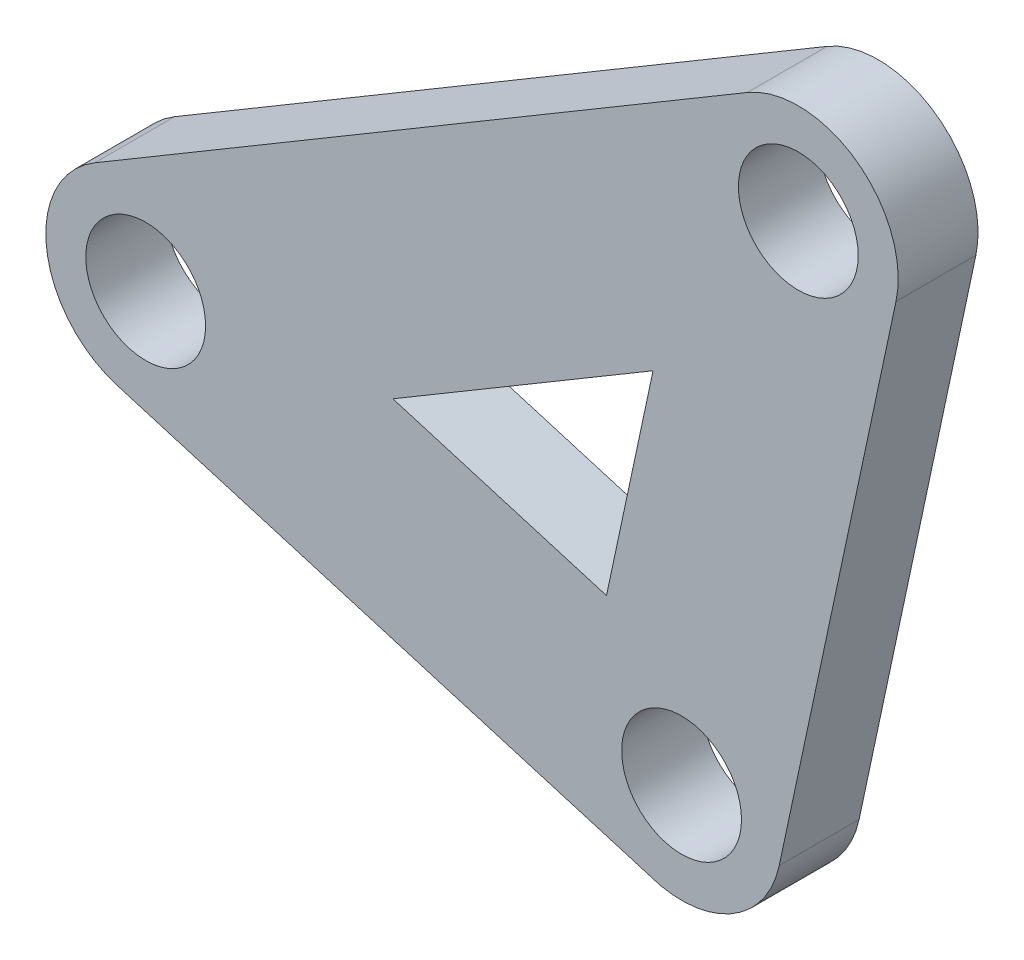
from build123d import *

# Parameters (mm, degrees)
BOSS_EXTRU_1_DEPTH      = 2
ESQUISSE2_R             = 1.5
ENL_V_MAT_EXTRU_1_DEPTH = 2


with BuildPart() as part:
    # Esquisse1 → Boss.-Extru.1 (new body)
    with BuildSketch(Plane.XY):
        with BuildLine():
            ThreePointArc((-30.69312299, 5.146506838), (-29.724192295, 5.477574873), (-28.703807813, 5.392438272))
            Line((-28.703807813, 5.392438272), (-23.228481357, 3.761582946))
            Line((-23.228481357, 3.761582946), (-16.714786598, 7.626279325))
            Line((-16.714786598, 7.626279325), (-15.522036632, 13.213428546))
            ThreePointArc((-15.522036632, 13.213428546), (-15.107728814, 14.149794802), (-14.352789293, 14.841531062))
            Line((-14.352789293, 14.841531062), (-30.69312299, 5.146506838))
        make_face()
        with BuildLine():
            Line((-23.228481357, 3.761582946), (-28.703807813, 5.392438272))
            ThreePointArc((-28.703807813, 5.392438272), (-29.724192295, 5.477574873), (-30.69312299, 5.146506838))
            ThreePointArc((-30.69312299, 5.146506838), (-31.89857385, 2.689732543), (-30.131116002, 0.60048759))
            ThreePointArc((-30.131116002, 0.60048759), (-29.11073152, 0.515350989), (-28.141800825, 0.846419024))
            Line((-28.141800825, 0.846419024), (-23.228481357, 3.761582946))
        make_face()
        with BuildLine():
            ThreePointArc((-28.141800825, 0.846419024), (-29.11073152, 0.515350989), (-30.131116002, 0.60048759))
            Line((-30.131116002, 0.60048759), (-16.898324022, -3.333026779))
            ThreePointArc((-16.898324022, -3.333026779), (-18.198183706, -2.190793179), (-18.44490842, -0.478058609))
            Line((-18.44490842, -0.478058609), (-17.879921595, 2.168485758))
            Line((-17.879921595, 2.168485758), (-23.228481357, 3.761582946))
            Line((-23.228481357, 3.761582946), (-28.141800825, 0.846419024))
        make_face()
        with BuildLine():
            Line((-15.286345905, 1.395975341), (-17.879921595, 2.168485758))
            Line((-17.879921595, 2.168485758), (-18.44490842, -0.478058609))
            ThreePointArc((-18.44490842, -0.478058609), (-18.198183706, -2.190793179), (-16.898324022, -3.333026779))
            Line((-16.898324022, -3.333026779), (-16.521941391, -3.44490842))
            ThreePointArc((-16.521941391, -3.44490842), (-14.640256973, -3.09787962), (-13.55509158, -1.521941391))
            ThreePointArc((-13.55509158, -1.521941391), (-13.849956093, 0.275661082), (-15.286345905, 1.395975341))
        make_face()
        with BuildLine():
            Line((-16.714786598, 7.626279325), (-17.879921595, 2.168485758))
            Line((-17.879921595, 2.168485758), (-15.286345905, 1.395975341))
            ThreePointArc((-15.286345905, 1.395975341), (-13.849956093, 0.275661082), (-13.55509158, -1.521941391))
            Line((-13.55509158, -1.521941391), (-10.632219791, 12.169545764))
            ThreePointArc((-10.632219791, 12.169545764), (-11.046527609, 11.233179508), (-11.801467129, 10.541443247))
            Line((-11.801467129, 10.541443247), (-16.714786598, 7.626279325))
        make_face()
        with BuildLine():
            Line((-15.522036632, 13.213428546), (-16.714786598, 7.626279325))
            Line((-16.714786598, 7.626279325), (-11.801467129, 10.541443247))
            ThreePointArc((-11.801467129, 10.541443247), (-11.046527609, 11.233179508), (-10.632219791, 12.169545764))
            ThreePointArc((-10.632219791, 12.169545764), (-11.618820564, 14.722087757), (-14.352789293, 14.841531062))
            ThreePointArc((-14.352789293, 14.841531062), (-15.107728814, 14.149794802), (-15.522036632, 13.213428546))
        make_face()
    extrude(amount=-BOSS_EXTRU_1_DEPTH)

    # Esquisse2 → Enlèv. mat.-Extru.1 (cut)
    with BuildSketch(Plane.XY):
        with Locations((-29.417461908, 2.996462931)):
            Circle(ESQUISSE2_R)
        with Locations((-16, -1)):
            Circle(ESQUISSE2_R)
        with Locations((-13.077128211, 12.691487155)):
            Circle(ESQUISSE2_R)
    extrude(amount=-ENL_V_MAT_EXTRU_1_DEPTH, mode=Mode.SUBTRACT)


solid = part.part
